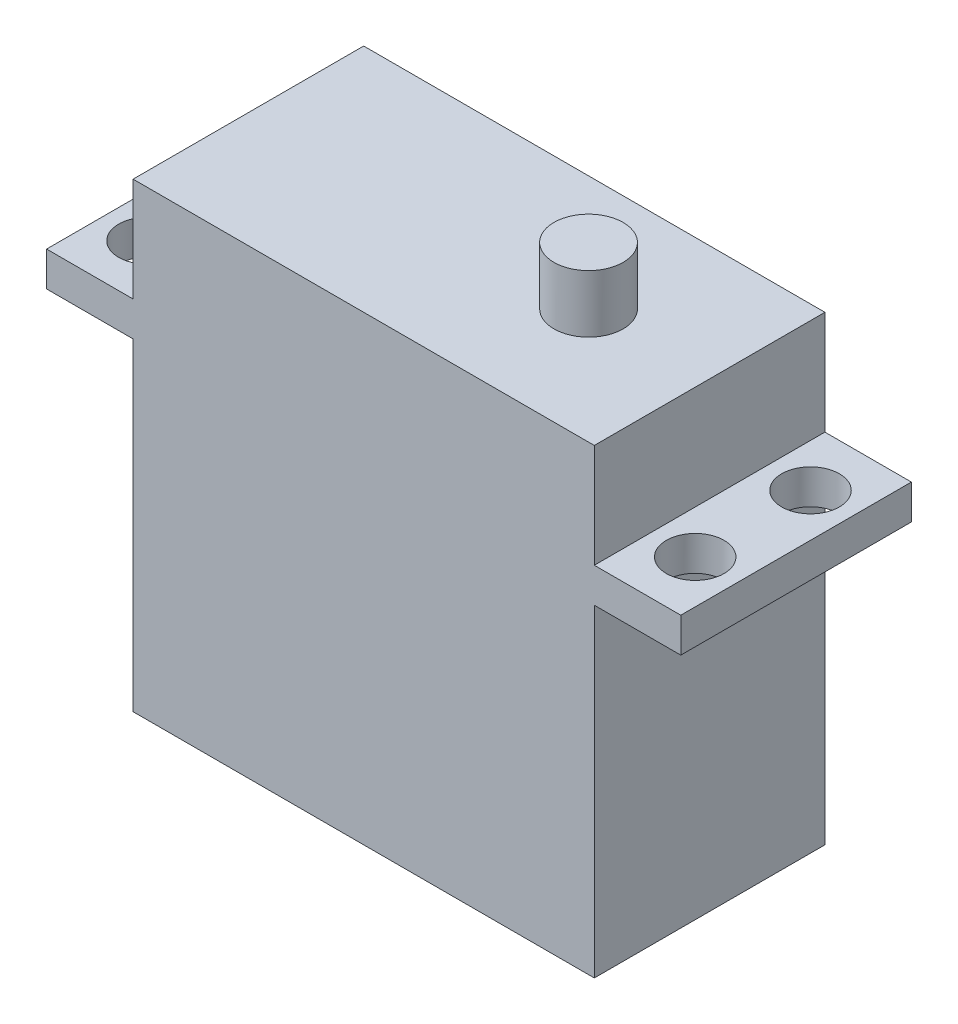
from build123d import *

# Parameters (mm, degrees)
SKETCH1_W           = 40
SKETCH1_H           = 40
BOSS_EXTRUDE1_DEPTH = 20
SKETCH2_R           = 3
BOSS_EXTRUDE2_DEPTH = 5
SKETCH3_W           = 20
SKETCH3_H           = 3
BOSS_EXTRUDE3_DEPTH = 7.5
SKETCH4_R           = 2.5
CUT_EXTRUDE1_DEPTH  = 7.5


with BuildPart() as part:
    # Sketch1 → Boss-Extrude1 (new body)
    with BuildSketch(Plane.XY):
        Rectangle(SKETCH1_W, SKETCH1_H)
    extrude(amount=BOSS_EXTRUDE1_DEPTH)

    # Sketch2 → Boss-Extrude2 (add)
    with BuildSketch(Plane(origin=(0, 20, 0), x_dir=(1, 0, 0), z_dir=(0, 1, 0))):
        with Locations(Location((9.5, -10, 0), (0, 0, 90))):
            Circle(SKETCH2_R)
    extrude(amount=BOSS_EXTRUDE2_DEPTH)

    # Sketch3 → Boss-Extrude3 (add)
    with BuildSketch(Plane.ZY.offset(20)):
        with Locations((10, 9.5)):
            Rectangle(SKETCH3_W, SKETCH3_H)
    boss_extrude3 = extrude(amount=BOSS_EXTRUDE3_DEPTH)

    # Sketch4 → Cut-Extrude1 (cut)
    with BuildSketch(Plane(origin=(0, 11, 0), x_dir=(1, 0, 0), z_dir=(0, 1, 0))):
        with Locations(Location((-23.75, -5, 0), (0, 0, 270))):
            Circle(SKETCH4_R)
        with Locations(Location((-23.75, -15, 0), (0, 0, 270))):
            Circle(SKETCH4_R)
    cut_extrude1 = extrude(amount=-CUT_EXTRUDE1_DEPTH, mode=Mode.SUBTRACT)

    # Mirror1: Boss-Extrude3, Cut-Extrude1 across plane
    add(boss_extrude3.mirror(Plane(origin=(0, 0, 0), x_dir=(0, 0, 1), z_dir=(1, 0, 0))))
    add(cut_extrude1.mirror(Plane(origin=(0, 0, 0), x_dir=(0, 0, 1), z_dir=(1, 0, 0))), mode=Mode.SUBTRACT)


solid = part.part
